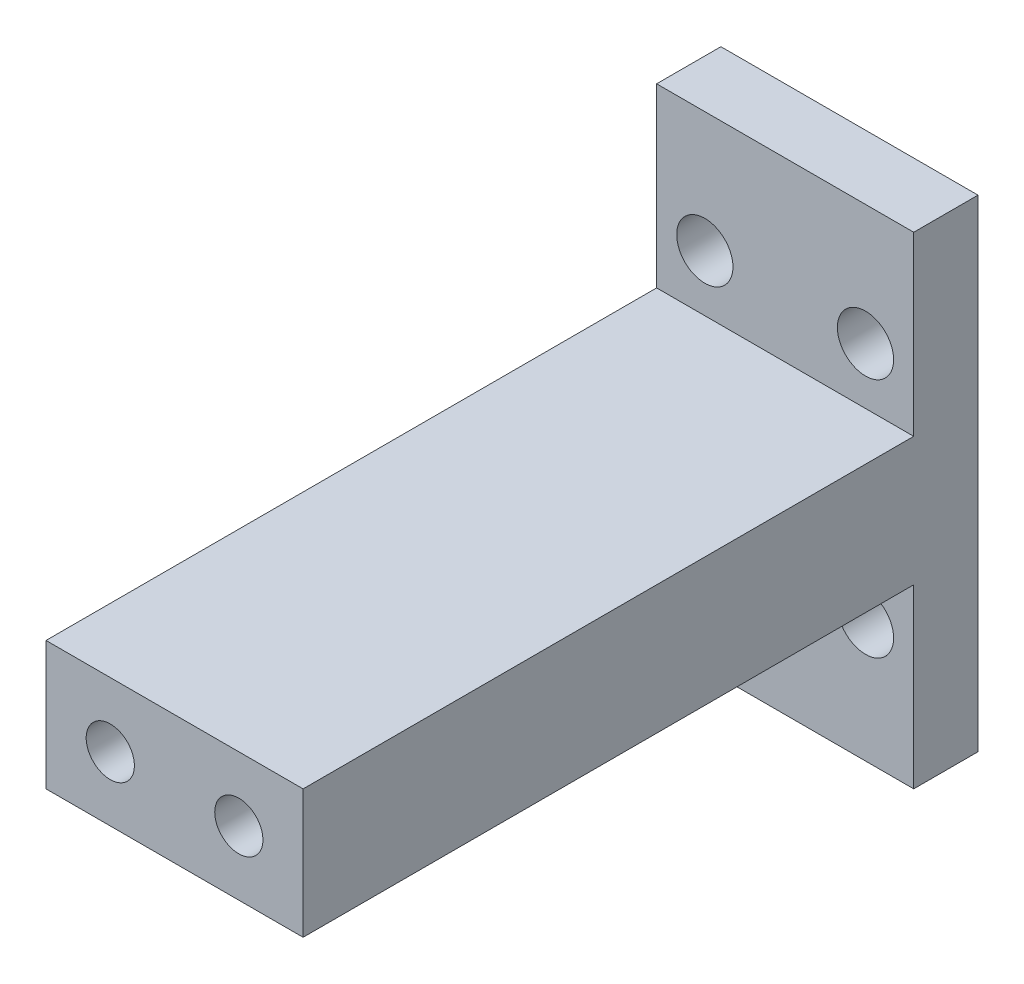
from build123d import *

# Parameters (mm, degrees)
SKETCH_1_W          = 16
SKETCH_1_H          = 30
SKETCH_1_R          = 1.75
EXTRUDE_3_DEPTH     = 4
SKETCH_4_W          = 16
SKETCH_4_H          = 8
EXTRUDE_4_DEPTH     = 38
SKETCH_6_R          = 1.5
CUT_EXTRUDE_1_DEPTH = 10


with BuildPart() as part:
    # 草图1 → 凸台-拉伸3 (new body)
    with BuildSketch(Plane.XY):
        Rectangle(SKETCH_1_W, SKETCH_1_H)
        with Locations((-5, 7.5)):
            Circle(SKETCH_1_R, mode=Mode.SUBTRACT)
        with Locations(Location((5, 7.5, 0), (0, 0, 180))):
            Circle(SKETCH_1_R, mode=Mode.SUBTRACT)
        with Locations((5, -7.5)):
            Circle(SKETCH_1_R, mode=Mode.SUBTRACT)
        with Locations(Location((-5, -7.5, 0), (0, 0, 180))):
            Circle(SKETCH_1_R, mode=Mode.SUBTRACT)
    extrude(amount=EXTRUDE_3_DEPTH)

    # 草图4 → 凸台-拉伸4 (add)
    with BuildSketch(Plane.XY.offset(4)):
        Rectangle(SKETCH_4_W, SKETCH_4_H)
    extrude(amount=EXTRUDE_4_DEPTH)

    # 草图6 → 切除-拉伸1 (cut)
    with BuildSketch(Plane.XY.offset(42)):
        with Locations((-4, 0)):
            Circle(SKETCH_6_R)
        with Locations(Location((4, 0, 0), (0, 0, 180))):
            Circle(SKETCH_6_R)
    extrude(amount=-CUT_EXTRUDE_1_DEPTH, mode=Mode.SUBTRACT)


solid = part.part
